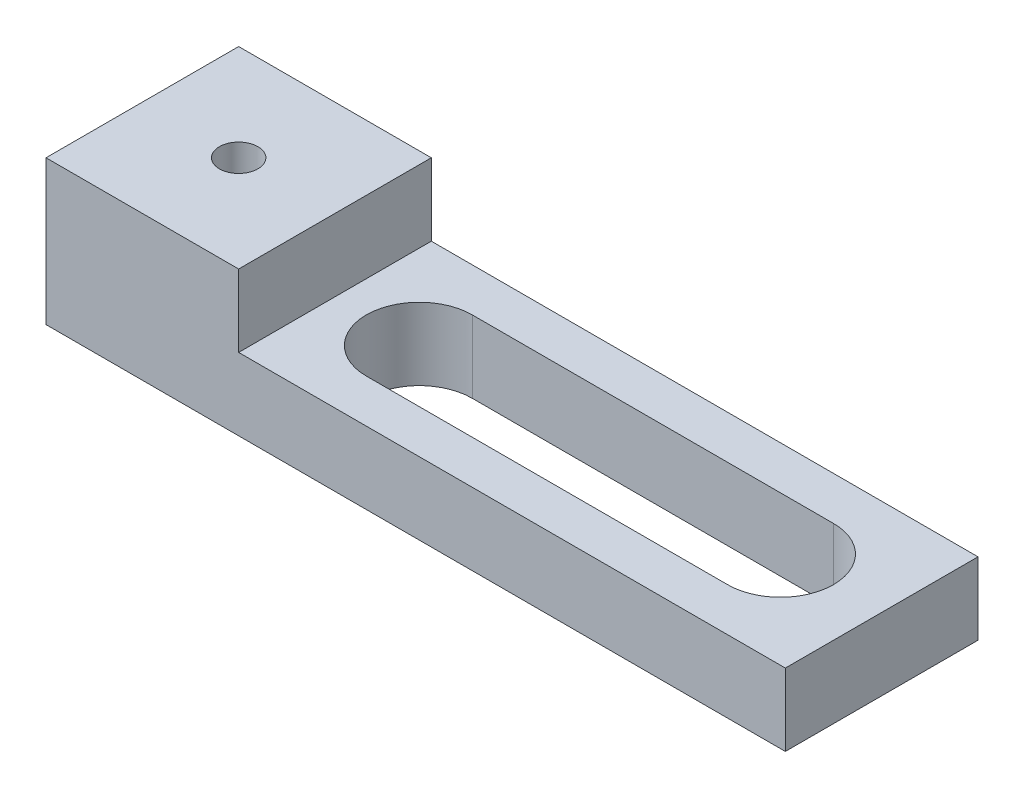
from build123d import *

# Parameters (mm, degrees)
SKETCH1_W           = 30.7
SKETCH1_H           = 8
BOSS_EXTRUDE1_DEPTH = 3
SKETCH2_W           = 8
SKETCH2_H           = 8
BOSS_EXTRUDE2_DEPTH = 3
CUT_EXTRUDE1_REACH  = 22.51
SKETCH3_R           = 0.8


with BuildPart() as part:
    # Sketch1 → Boss-Extrude1 (new body)
    with BuildSketch(Plane(origin=(0, 0, 0), x_dir=(1, 0, 0), z_dir=(0, 1, 0))):
        with Locations((3.85, 0)):
            Rectangle(SKETCH1_W, SKETCH1_H)
        with BuildLine():
            Line((0, 2.2), (15, 2.2))
            ThreePointArc((15, 2.2), (17.2, 0), (15, -2.2))
            Line((15, -2.2), (0, -2.2))
            ThreePointArc((0, -2.2), (-2.2, 0), (0, 2.2))
        make_face(mode=Mode.SUBTRACT)
    extrude(amount=BOSS_EXTRUDE1_DEPTH)

    # Sketch2 → Boss-Extrude2 (add)
    with BuildSketch(Plane(origin=(0, 3, 0), x_dir=(1, 0, 0), z_dir=(0, 1, 0))):
        with Locations((-7.5, 0)):
            Rectangle(SKETCH2_W, SKETCH2_H)
    extrude(amount=BOSS_EXTRUDE2_DEPTH)

    # Sketch3 → Cut-Extrude1 (cut, up to next)
    with BuildSketch(Plane(origin=(0, 6, 0), x_dir=(1, 0, 0), z_dir=(0, 1, 0)), mode=Mode.PRIVATE) as cut_extrude1_sk1:
        with Locations(Location((-7.5, 0, 0), (0, 0, 270))):
            Circle(SKETCH3_R)
    cut_extrude1_tool1 = extrude(cut_extrude1_sk1.sketch, amount=-CUT_EXTRUDE1_REACH, mode=Mode.PRIVATE) & part.part
    add(cut_extrude1_tool1.solids().sort_by_distance((-7.5, 6, 0))[0], mode=Mode.SUBTRACT)


solid = part.part
